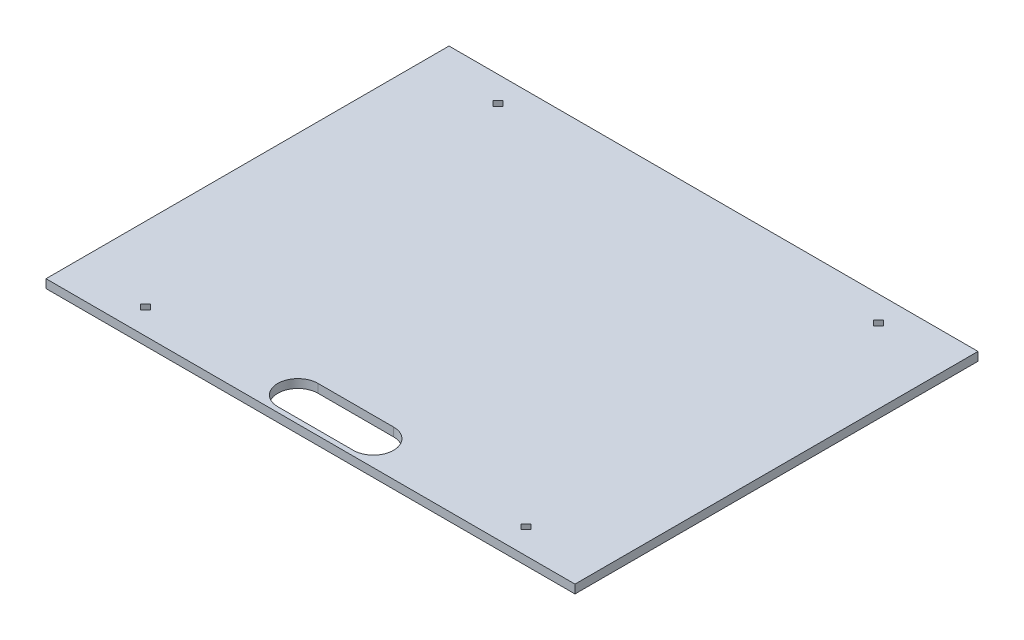
from build123d import *

# Parameters (mm, degrees)
SKETCH_1_W      = 105
SKETCH_1_H      = 80
EXTRUDE_1_DEPTH = 1.702337868


with BuildPart() as part:
    # 草图1 → 凸台-拉伸1 (new body)
    with BuildSketch(Plane(origin=(0, 0, 0), x_dir=(1, 0, 0), z_dir=(0, 1, 0))):
        Rectangle(SKETCH_1_W, SKETCH_1_H)
        Polygon((38.759288178, 35), (37.759288178, 34), (36.759288178, 35), (37.759288178, 36), align=None, mode=Mode.SUBTRACT)
        Polygon((-37.759288178, 34), (-36.759288178, 35), (-37.759288178, 36), (-38.759288178, 35), align=None, mode=Mode.SUBTRACT)
        Polygon((37.759288178, -36), (38.759288178, -35), (37.759288178, -34), (36.759288178, -35), align=None, mode=Mode.SUBTRACT)
        Polygon((-38.759288178, -35), (-37.759288178, -34), (-36.759288178, -35), (-37.759288178, -36), align=None, mode=Mode.SUBTRACT)
        with BuildLine():
            Line((-7.5, -39), (7.5, -39))
            ThreePointArc((7.5, -39), (11.5, -35), (7.5, -31))
            Line((7.5, -31), (-7.5, -31))
            ThreePointArc((-7.5, -31), (-11.5, -35), (-7.5, -39))
        make_face(mode=Mode.SUBTRACT)
    extrude(amount=EXTRUDE_1_DEPTH)


solid = part.part
